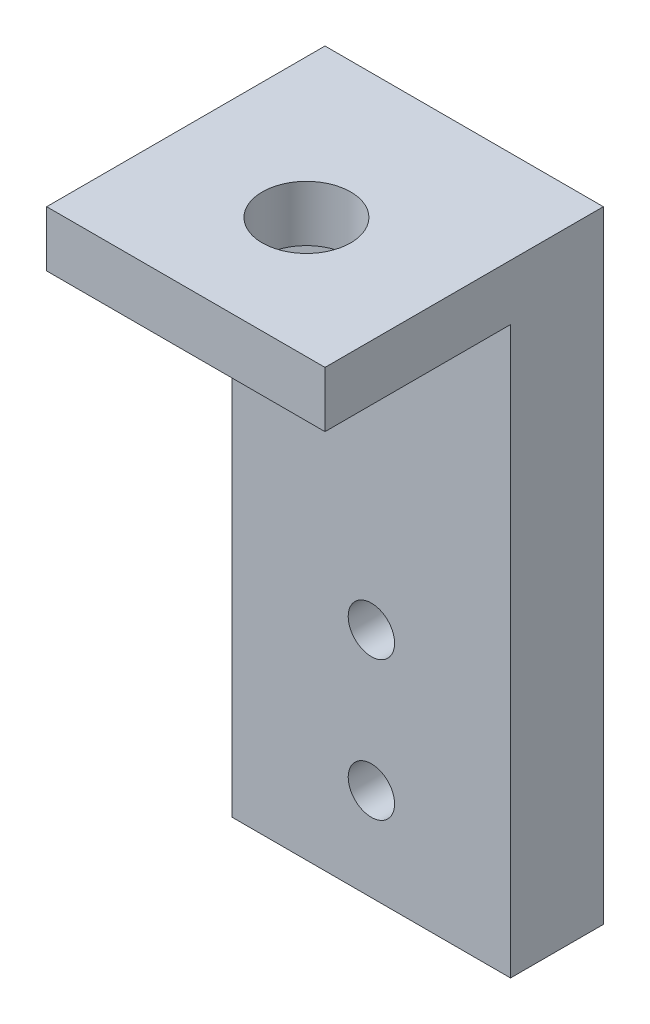
from build123d import *

# Parameters (mm, degrees)
ESBO_O1_W                = 30
ESBO_O1_H                = 67
RESSALTO_EXTRUS_O1_DEPTH = 10
ESBO_O2_W                = 30
ESBO_O2_H                = 6
RESSALTO_EXTRUS_O2_DEPTH = 20
CORTE_EXTRUS_O1_REACH    = 76.927
ESBO_O3_R                = 4.765
ESBO_O4_R                = 2.5
CORTE_EXTRUS_O2_DEPTH    = 10


with BuildPart() as part:
    # Esboço1 → Ressalto-extrusão1 (new body)
    with BuildSketch(Plane.XY):
        Rectangle(ESBO_O1_W, ESBO_O1_H)
    extrude(amount=RESSALTO_EXTRUS_O1_DEPTH)

    # Esboço2 → Ressalto-extrusão2 (add)
    with BuildSketch(Plane.XY.offset(10)):
        with Locations((0, 30.5)):
            Rectangle(ESBO_O2_W, ESBO_O2_H)
    extrude(amount=RESSALTO_EXTRUS_O2_DEPTH)

    # Esboço3 → Corte-extrusão1 (cut, up to next)
    with BuildSketch(Plane(origin=(0, 33.5, 0), x_dir=(1, 0, 0), z_dir=(0, 1, 0)), mode=Mode.PRIVATE) as corte_extrus_o1_sk1:
        with Locations(Location((0, -17, 0), (0, 0, 270))):
            Circle(ESBO_O3_R)
    corte_extrus_o1_tool1 = extrude(corte_extrus_o1_sk1.sketch, amount=-CORTE_EXTRUS_O1_REACH, mode=Mode.PRIVATE) & part.part
    add(corte_extrus_o1_tool1.solids().sort_by_distance((0, 33.5, 17))[0], mode=Mode.SUBTRACT)

    # Esboço4 → Corte-extrusão2 (cut)
    with BuildSketch(Plane(origin=(0, 0, 0), x_dir=(-1, 0, 0), z_dir=(0, 0, -1))):
        with Locations((0, -23.5)):
            Circle(ESBO_O4_R)
        with Locations((0, -8.5)):
            Circle(ESBO_O4_R)
    extrude(amount=-CORTE_EXTRUS_O2_DEPTH, mode=Mode.SUBTRACT)


solid = part.part
